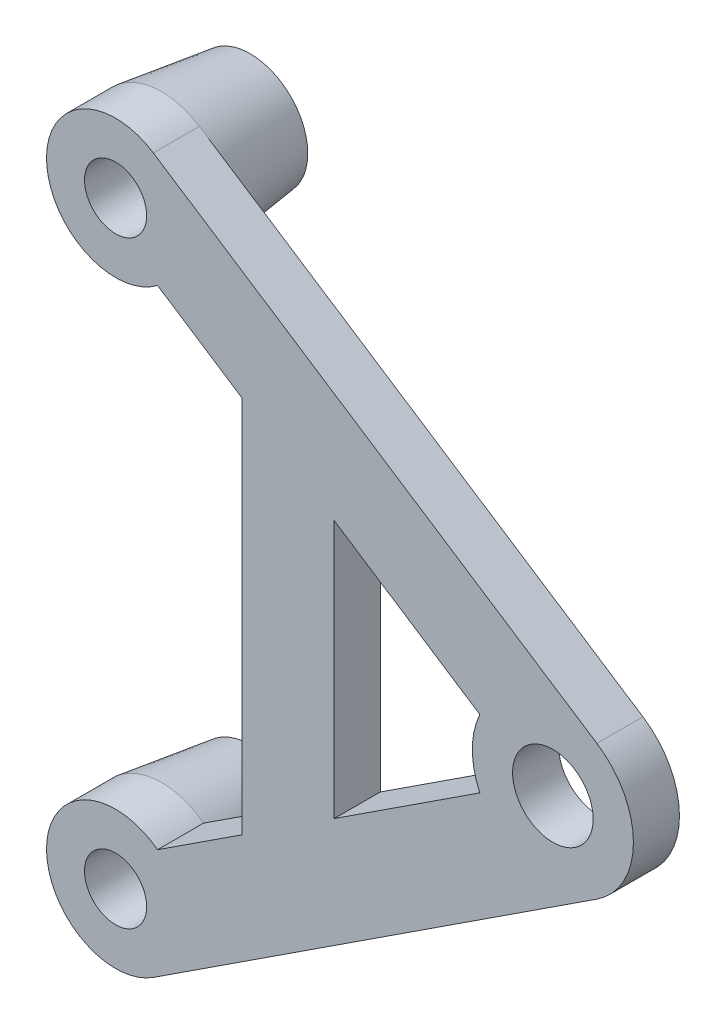
from build123d import *
from build123d.topology import SkipClean

# Parameters (mm, degrees)
SKETCH_1_R          = 2.2
SKETCH_1_R_2        = 3.5
SKETCH_1_R_3        = 2.7
EXTRUDE_1_DEPTH     = 4
SKETCH_5_R          = 2.2
CUT_EXTRUDE_1_DEPTH = 57.443688753


with BuildPart() as part:
    # 草图1 → 凸台-拉伸1 (new body)
    with BuildSketch(Plane.XY):
        with BuildLine():
            Line((-45, -12.5), (-22.796873936, -30.645831284))
            ThreePointArc((-22.796873936, -30.645831284), (-19.320397567, -31.991439343), (-15.720242852, -31.024260448))
            Line((-15.720242852, -31.024260448), (22.82638334, -5.861637189))
            ThreePointArc((22.82638334, -5.861637189), (26, 0), (22.82638334, 5.861637189))
            Line((22.82638334, 5.861637189), (-15.720242852, 31.024260448))
            ThreePointArc((-15.720242852, 31.024260448), (-19.320397567, 31.991439343), (-22.796873936, 30.645831284))
            Line((-22.796873936, 30.645831284), (-45, 12.5))
            Line((-45, 12.5), (-45, -12.5))
        make_face()
        with Locations((-35, 0)):
            Circle(SKETCH_1_R, mode=Mode.SUBTRACT)
        with Locations((-19, 0)):
            Circle(SKETCH_1_R, mode=Mode.SUBTRACT)
        with Locations((19, 0)):
            Circle(SKETCH_1_R_2, mode=Mode.SUBTRACT)
        with Locations((-19, -26)):
            Circle(SKETCH_1_R_3, mode=Mode.SUBTRACT)
        with Locations((-19, 26)):
            Circle(SKETCH_1_R_3, mode=Mode.SUBTRACT)
    extrude(amount=EXTRUDE_1_DEPTH)

    # 草图4 → 旋转1 (revolve)
    with SkipClean():  # the faces are left unmerged after this step: merging them gives an invalid solid
        with BuildSketch(Plane(origin=(-25.223829861, 16.46571414, 0), x_dir=(0, 0, -1), z_dir=(0.8373767412950733, -0.5466261914124163, 0))):
            Polygon((7.7, 16.385897637), (0, 17.385897637), (0, 14.085897637), (7.7, 14.085897637), align=None)
        revolve_1 = revolve(axis=Axis((-19, 26, 1000.278995542), (0, 0, -1)))

    # 镜向1: 旋转1 across plane
    with SkipClean():  # the faces are left unmerged after this step: merging them gives an invalid solid
        add(revolve_1.mirror(Plane.ZX))

    # 草图5 → 切除-拉伸1 (cut, through all)
    # profile 1 of 2: a face of its own
    with SkipClean():  # the faces are left unmerged after this step: merging them gives an invalid solid
        with BuildSketch(Plane.XY.offset(4)):
            with BuildLine():
                Line((-8, 16.430964093), (-15.356334205, 21.233061824))
                ThreePointArc((-15.356334205, 21.233061824), (-23.707008117, 22.279237365), (-22.796873936, 30.645831284))
                Line((-22.796873936, 30.645831284), (-45, 12.5))
                Line((-45, 12.5), (-45, -12.5))
                Line((-45, -12.5), (-22.796873936, -30.645831284))
                ThreePointArc((-22.796873936, -30.645831284), (-23.707008117, -22.279237365), (-15.356334205, -21.233061824))
                Line((-15.356334205, -21.233061824), (-8, -16.430964093))
                Line((-8, -16.430964093), (-8, 16.430964093))
            make_face()
            with Locations((-35, 0)):
                Circle(SKETCH_5_R, mode=Mode.SUBTRACT)
            with Locations((-19, 0)):
                Circle(SKETCH_5_R, mode=Mode.SUBTRACT)
        # profile 2 of 2: a face of its own
        with BuildSketch(Plane.XY.offset(4)):
            with BuildLine():
                Line((12.651857565, 2.949760604), (0, 11.208691589))
                Line((0, 11.208691589), (0, -11.208691589))
                Line((0, -11.208691589), (12.651857565, -2.949760604))
                ThreePointArc((12.651857565, -2.949760604), (12, 0), (12.651857565, 2.949760604))
            make_face()
        extrude(amount=-CUT_EXTRUDE_1_DEPTH, mode=Mode.SUBTRACT)


solid = part.part
